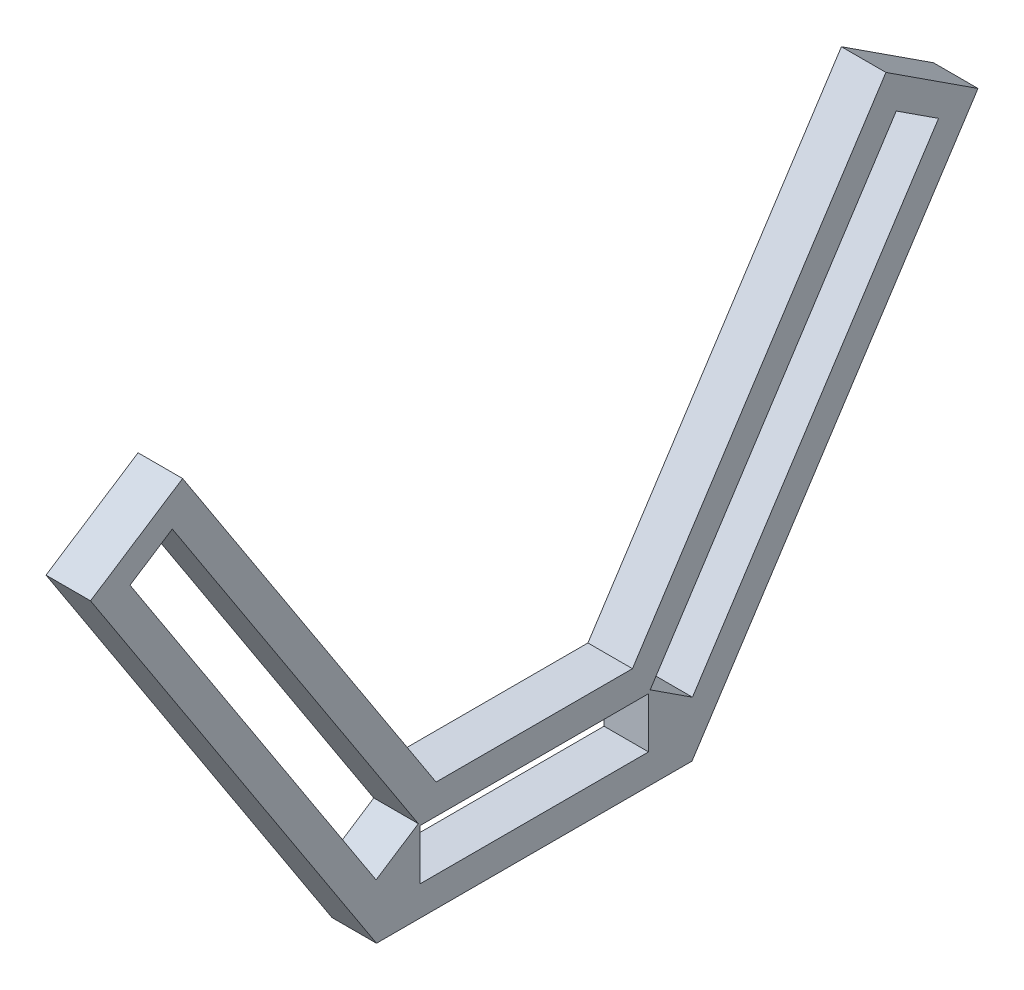
from build123d import *

# Parameters (mm, degrees)
SKETCH1_W           = 26.4
SKETCH1_H           = 3.4
BOSS_EXTRUDE1_DEPTH = 3
CUT_EXTRUDE1_DEPTH  = 3


with BuildPart() as part:
    # Sketch1 → Boss-Extrude1 (new body)
    with BuildSketch(Plane(origin=(0, 0, 0), x_dir=(0, 0, -1), z_dir=(1, 0, 0))):
        Polygon((-29.192028343, 26.236188028), (-35.394898574, 22.200794504), (-16.635771919, -6.634169813), (-16.129107702, -7.412971773), (-15.2, -7.412971773), (15.2, -7.412971773), (15.2, -0.012971773), (-12.115145296, -0.012971773), align=None)
        with Locations((0, -3.712971773)):
            Rectangle(SKETCH1_W, SKETCH1_H, mode=Mode.SUBTRACT)
        Polygon((-13.30906469, -1.845326631), (-29.886897548, 23.636734858), (-32.736864952, 21.78263513), (-16.159032093, -3.699426359), align=None, mode=Mode.SUBTRACT)
    extrude(amount=BOSS_EXTRUDE1_DEPTH)

    # Sketch2 → Cut-Extrude1 (cut)
    with BuildSketch(Plane(origin=(3, 0, 0), x_dir=(0, 0, -1), z_dir=(1, 0, 0))):
        Polygon((15.2, -0.012971773), (-5.5, -0.012971773), (-5.5, -2.012971773), (13.2, -2.012971773), (13.2, -5.412971773), (-5.5, -5.412971773), (-5.5, -7.412971773), (15.2, -7.412971773), align=None)
    extrude(amount=-CUT_EXTRUDE1_DEPTH, mode=Mode.SUBTRACT)

    # Mirror1: part across plane


with BuildPart() as part_1:
    add(part.part)
    add(part.part.mirror(Plane.XY.offset(5.5)))


solid = part_1.part
